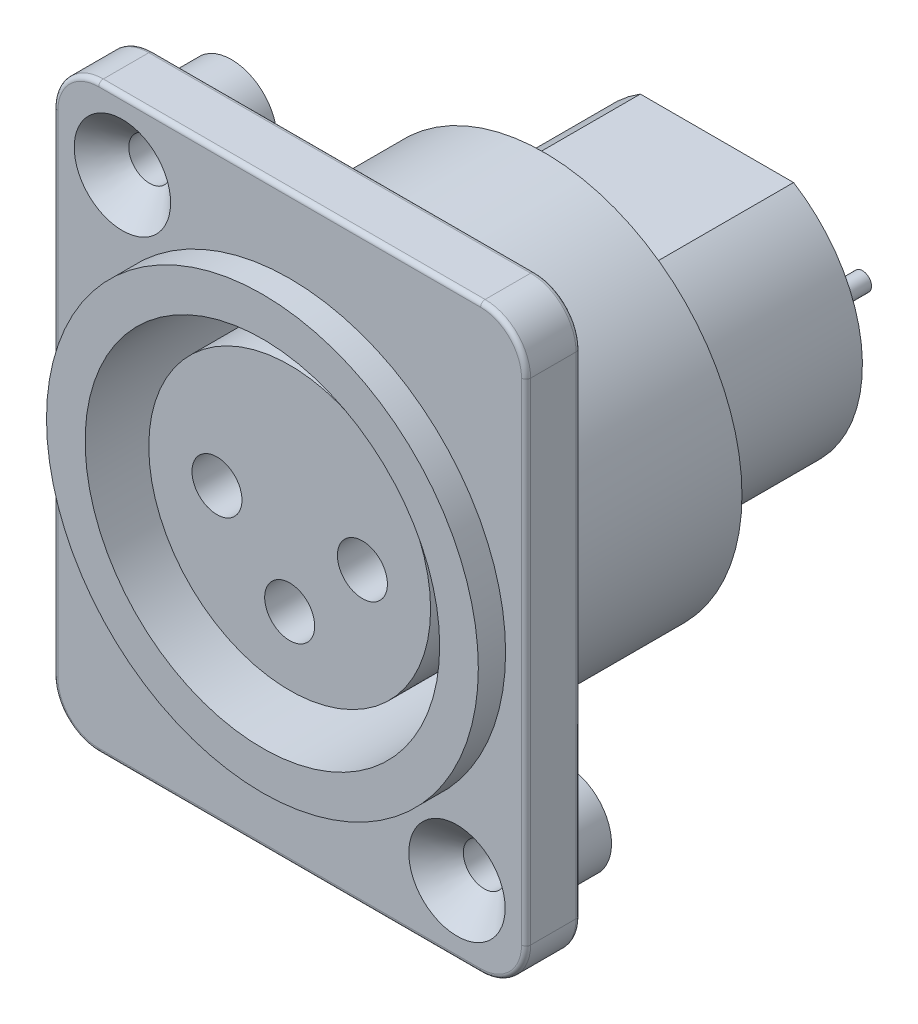
from build123d import *
from build123d.topology import SkipClean

# Parameters (mm, degrees)
SALIENTE_EXTRUIR1_DEPTH = 9.5
CROQUIS2_R              = 10.875
SALIENTE_EXTRUIR2_DEPTH = 11
CROQUIS3_W              = 26
CROQUIS3_H              = 32
SALIENTE_EXTRUIR3_DEPTH = 3
REDONDEO1_R             = 2.5
CROQUIS4_R              = 11.875
CROQUIS4_R_2            = 9.75
SALIENTE_EXTRUIR4_DEPTH = 1.5
CORTAR_EXTRUIR1_START   = -10
CROQUIS4_3_R            = 9.75
CROQUIS4_3_R_2          = 7.75
CROQUIS4_3_R_3          = 1.375
CORTAR_EXTRUIR1_DEPTH   = 10
CORTAR_EXTRUIR2_REACH   = 33.261
CROQUIS5_R              = 1.15
CHAFL_N1_SIZE           = 1.5
SALIENTE_EXTRUIR5_START = 1
CROQUIS6_R              = 1.375
SALIENTE_EXTRUIR5_DEPTH = 1
CROQUIS6_3_R            = 0.5
SALIENTE_EXTRUIR6_DEPTH = 4
REDONDEO2_R             = 0.25
CROQUIS7_R              = 2.5
CROQUIS7_R_2            = 1.15
SALIENTE_EXTRUIR7_DEPTH = 3


with BuildPart() as part:
    # Croquis1 → Saliente-Extruir1 (new body)
    with BuildSketch(Plane.XY):
        with BuildLine():
            Line((-4.214261501, 6.8), (4.214261501, 6.8))
            ThreePointArc((4.214261501, 6.8), (0, -8), (-4.214261501, 6.8))
        make_face()
    extrude(amount=SALIENTE_EXTRUIR1_DEPTH)

    # Croquis2 → Saliente-Extruir2 (add)
    with BuildSketch(Plane.XY.offset(9.5)):
        Circle(CROQUIS2_R)
    extrude(amount=SALIENTE_EXTRUIR2_DEPTH)

    # Croquis3 → Saliente-Extruir3 (add)
    with BuildSketch(Plane.XY.offset(20.5)):
        Rectangle(CROQUIS3_W, CROQUIS3_H)
    extrude(amount=SALIENTE_EXTRUIR3_DEPTH)

    # Redondeo1
    redondeo1_edges = [part.edges().sort_by_distance(p)[0] for p in [
        (13, -16, 22),
        (-13, -16, 22),
        (-13, 16, 22),
        (13, 16, 22),
    ]]
    fillet(redondeo1_edges, radius=REDONDEO1_R)

    # Croquis4 → Saliente-Extruir4 (add)
    with BuildSketch(Plane.XY.offset(23.5)):
        Circle(CROQUIS4_R)
        Circle(CROQUIS4_R_2, mode=Mode.SUBTRACT)
    extrude(amount=SALIENTE_EXTRUIR4_DEPTH)

    # Croquis4<3> → Cortar-Extruir1 (cut)
    # profile 1 of 4: a face of its own
    with BuildSketch(Plane.XY.offset(23.5).offset(CORTAR_EXTRUIR1_START)):
        Circle(CROQUIS4_3_R)
        Circle(CROQUIS4_3_R_2, mode=Mode.SUBTRACT)
    # profile 2 of 4: a face of its own
    with BuildSketch(Plane.XY.offset(23.5).offset(CORTAR_EXTRUIR1_START)):
        with Locations((-4, 0)):
            Circle(CROQUIS4_3_R_3)
    # profile 3 of 4: a face of its own
    with BuildSketch(Plane.XY.offset(23.5).offset(CORTAR_EXTRUIR1_START)):
        with Locations((0, -4)):
            Circle(CROQUIS4_3_R_3)
    # profile 4 of 4: a face of its own
    with BuildSketch(Plane.XY.offset(23.5).offset(CORTAR_EXTRUIR1_START)):
        with Locations((4, 0)):
            Circle(CROQUIS4_3_R_3)
    extrude(amount=CORTAR_EXTRUIR1_DEPTH, mode=Mode.SUBTRACT)

    # Croquis5 → Cortar-Extruir2 (cut, up to next)
    with BuildSketch(Plane.XY.offset(23.5), mode=Mode.PRIVATE) as cortar_extruir2_sk1:
        with Locations((-9.2, 12.2)):
            Circle(CROQUIS5_R)
    cortar_extruir2_tool1 = extrude(cortar_extruir2_sk1.sketch, amount=-CORTAR_EXTRUIR2_REACH, mode=Mode.PRIVATE) & part.part
    # Croquis5 → Cortar-Extruir2 (cut, up to next)
    with BuildSketch(Plane.XY.offset(23.5), mode=Mode.PRIVATE) as cortar_extruir2_sk2:
        with Locations((9.2, -12.2)):
            Circle(CROQUIS5_R)
    cortar_extruir2_tool2 = extrude(cortar_extruir2_sk2.sketch, amount=-CORTAR_EXTRUIR2_REACH, mode=Mode.PRIVATE) & part.part
    add(cortar_extruir2_tool1.solids().sort_by_distance((-9.2, 12.2, 23.5))[0], mode=Mode.SUBTRACT)
    add(cortar_extruir2_tool2.solids().sort_by_distance((9.2, -12.2, 23.5))[0], mode=Mode.SUBTRACT)

    # Chaflán1
    chafl_n1_edges = [part.edges().sort_by_distance(p)[0] for p in [
        (8.05, -12.2, 23.5),
        (-10.35, 12.2, 23.5),
    ]]
    chamfer(chafl_n1_edges, length=CHAFL_N1_SIZE)

    # Croquis6 → Saliente-Extruir5 (add)
    with BuildSketch(Plane(origin=(0, 0, 0), x_dir=(-1, 0, 0), z_dir=(0, 0, -1)).offset(SALIENTE_EXTRUIR5_START)):
        with Locations((-4, 0)):
            Circle(CROQUIS6_R)
        with Locations((4, 0)):
            Circle(CROQUIS6_R)
        with Locations((0, -4)):
            Circle(CROQUIS6_R)
    extrude(amount=-SALIENTE_EXTRUIR5_DEPTH)

    # Croquis6<3> → Saliente-Extruir6 (add)
    with BuildSketch(Plane(origin=(0, 0, 0), x_dir=(-1, 0, 0), z_dir=(0, 0, -1))):
        with Locations((-4, 0)):
            Circle(CROQUIS6_3_R)
        with Locations((0, -4)):
            Circle(CROQUIS6_3_R)
        with Locations((4, 0)):
            Circle(CROQUIS6_3_R)
    extrude(amount=SALIENTE_EXTRUIR6_DEPTH)

    # Redondeo2
    redondeo2_edges = [part.edges().sort_by_distance(p)[0] for p in [
        (12.267766953, 15.267766953, 20.5),
        (13, 0, 20.5),
        (12.267766953, -15.267766953, 20.5),
        (0, -16, 20.5),
        (-12.267766953, -15.267766953, 20.5),
        (-13, 0, 20.5),
        (-12.267766953, 15.267766953, 20.5),
        (12.267766953, 15.267766953, 23.5),
        (13, 0, 23.5),
        (12.267766953, -15.267766953, 23.5),
        (0, -16, 23.5),
        (-12.267766953, -15.267766953, 23.5),
        (-13, 0, 23.5),
        (-12.267766953, 15.267766953, 23.5),
        (0, 16, 20.5),
        (0, 16, 23.5),
    ]]
    fillet(redondeo2_edges, radius=REDONDEO2_R)

    # Croquis7 → Saliente-Extruir7 (add)
    # profile 1 of 2: a face of its own
    with SkipClean():  # the faces are left unmerged after this step: merging them gives an invalid solid
        with BuildSketch(Plane(origin=(0, 0, 20.5), x_dir=(-1, 0, 0), z_dir=(0, 0, -1))):
            with Locations((-9.2, -12.2)):
                Circle(CROQUIS7_R)
            with Locations((-9.2, -12.2)):
                Circle(CROQUIS7_R_2, mode=Mode.SUBTRACT)
        # profile 2 of 2: a face of its own
        with BuildSketch(Plane(origin=(0, 0, 20.5), x_dir=(-1, 0, 0), z_dir=(0, 0, -1))):
            with Locations((9.2, 12.2)):
                Circle(CROQUIS7_R)
            with Locations((9.2, 12.2)):
                Circle(CROQUIS7_R_2, mode=Mode.SUBTRACT)
        extrude(amount=SALIENTE_EXTRUIR7_DEPTH)


solid = part.part
